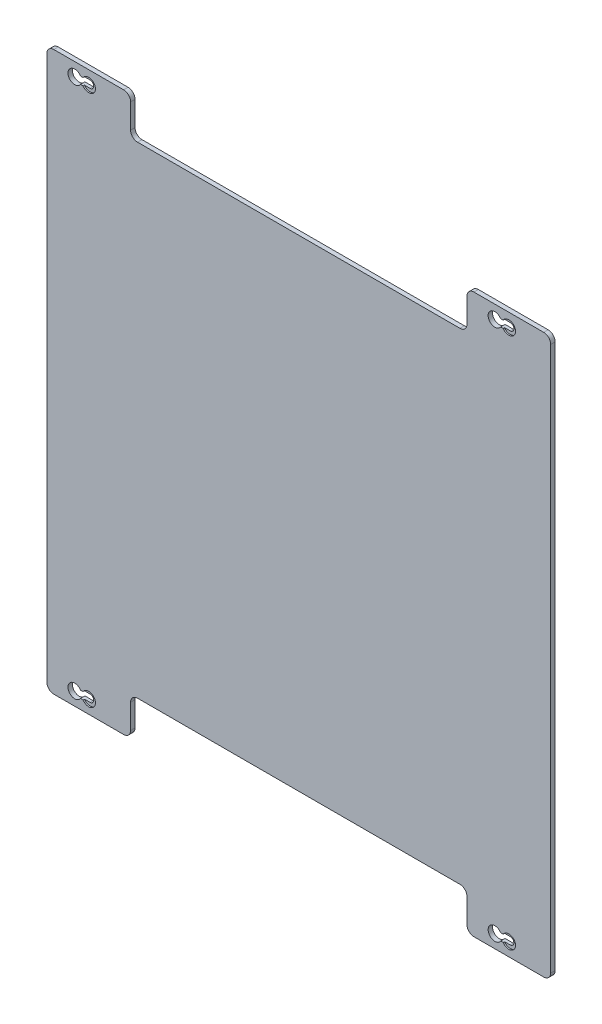
from build123d import *

# Parameters (mm, degrees)
BOSS_EXTRUDE1_DEPTH = 3.175
SKETCH2_R           = 4.8
CUT_EXTRUDE1_DEPTH  = 1


with BuildPart() as part:
    # Model → Boss-Extrude1 (new body)
    with BuildSketch(Plane.XY):
        with BuildLine():
            Line((175.500000042, 200), (125.500000042, 200))
            ThreePointArc((125.500000042, 200), (121.964466136, 198.535533906), (120.500000042, 195))
            Line((120.500000042, 195), (120.500000042, 177.5))
            ThreePointArc((120.500000042, 177.5), (119.035533948, 173.964466094), (115.500000042, 172.5))
            Line((115.500000042, 172.5), (-115.500000042, 172.5))
            ThreePointArc((-115.500000042, 172.5), (-119.035533948, 173.964466094), (-120.500000042, 177.5))
            Line((-120.500000042, 177.5), (-120.500000042, 195))
            ThreePointArc((-120.500000042, 195), (-121.964466136, 198.535533906), (-125.500000042, 200))
            Line((-125.500000042, 200), (-175.500000042, 200))
            ThreePointArc((-175.500000042, 200), (-179.035533948, 198.535533906), (-180.500000042, 195))
            Line((-180.500000042, 195), (-180.500000042, -195))
            ThreePointArc((-180.500000042, -195), (-179.035533948, -198.535533906), (-175.500000042, -200))
            Line((-175.500000042, -200), (-125.500000042, -200))
            ThreePointArc((-125.500000042, -200), (-121.964466136, -198.535533906), (-120.500000042, -195))
            Line((-120.500000042, -195), (-120.500000042, -177.5))
            ThreePointArc((-120.500000042, -177.5), (-119.035533948, -173.964466094), (-115.500000042, -172.5))
            Line((-115.500000042, -172.5), (115.500000042, -172.5))
            ThreePointArc((115.500000042, -172.5), (119.035533948, -173.964466094), (120.500000042, -177.5))
            Line((120.500000042, -177.5), (120.500000042, -195))
            ThreePointArc((120.500000042, -195), (121.964466136, -198.535533906), (125.500000042, -200))
            Line((125.500000042, -200), (175.500000042, -200))
            ThreePointArc((175.500000042, -200), (179.035533948, -198.535533906), (180.500000042, -195))
            Line((180.500000042, -195), (180.500000042, 195))
            ThreePointArc((180.500000042, 195), (179.035533948, 198.535533906), (175.500000042, 200))
        make_face()
        with BuildLine():
            Line((144.600753463, 187.910343452), (150.5, 187.910343452))
            ThreePointArc((150.5, 187.910343452), (153.089656548, 190.5), (150.5, 193.089656548))
            Line((150.5, 193.089656548), (144.600753463, 193.089656548))
            ThreePointArc((144.600753463, 193.089656548), (135.65, 190.5), (144.600753463, 187.910343452))
        make_face(mode=Mode.SUBTRACT)
        with BuildLine():
            Line((150.5, -187.910343452), (144.600753463, -187.910343452))
            ThreePointArc((144.600753463, -187.910343452), (135.65, -190.5), (144.600753463, -193.089656548))
            Line((144.600753463, -193.089656548), (150.5, -193.089656548))
            ThreePointArc((150.5, -193.089656548), (153.089656548, -190.5), (150.5, -187.910343452))
        make_face(mode=Mode.SUBTRACT)
        with BuildLine():
            Line((-150.5, -187.910343452), (-156.399246537, -187.910343452))
            ThreePointArc((-156.399246537, -187.910343452), (-165.35, -190.5), (-156.399246537, -193.089656548))
            Line((-156.399246537, -193.089656548), (-150.5, -193.089656548))
            ThreePointArc((-150.5, -193.089656548), (-147.910343452, -190.5), (-150.5, -187.910343452))
        make_face(mode=Mode.SUBTRACT)
        with BuildLine():
            Line((-150.5, 193.089656548), (-156.399246537, 193.089656548))
            ThreePointArc((-156.399246537, 193.089656548), (-165.35, 190.5), (-156.399246537, 187.910343452))
            Line((-156.399246537, 187.910343452), (-150.5, 187.910343452))
            ThreePointArc((-150.5, 187.910343452), (-147.910343452, 190.5), (-150.5, 193.089656548))
        make_face(mode=Mode.SUBTRACT)
    extrude(amount=BOSS_EXTRUDE1_DEPTH)

    # Sketch2 → Cut-Extrude1 (cut)
    with BuildSketch(Plane.XY.offset(3.175)):
        with Locations((-150.5, 190.5)):
            Circle(SKETCH2_R)
        with Locations((150.5, 190.5)):
            Circle(SKETCH2_R)
        with Locations((150.5, -190.5)):
            Circle(SKETCH2_R)
        with Locations((-150.5, -190.5)):
            Circle(SKETCH2_R)
    extrude(amount=-CUT_EXTRUDE1_DEPTH, mode=Mode.SUBTRACT)


solid = part.part
